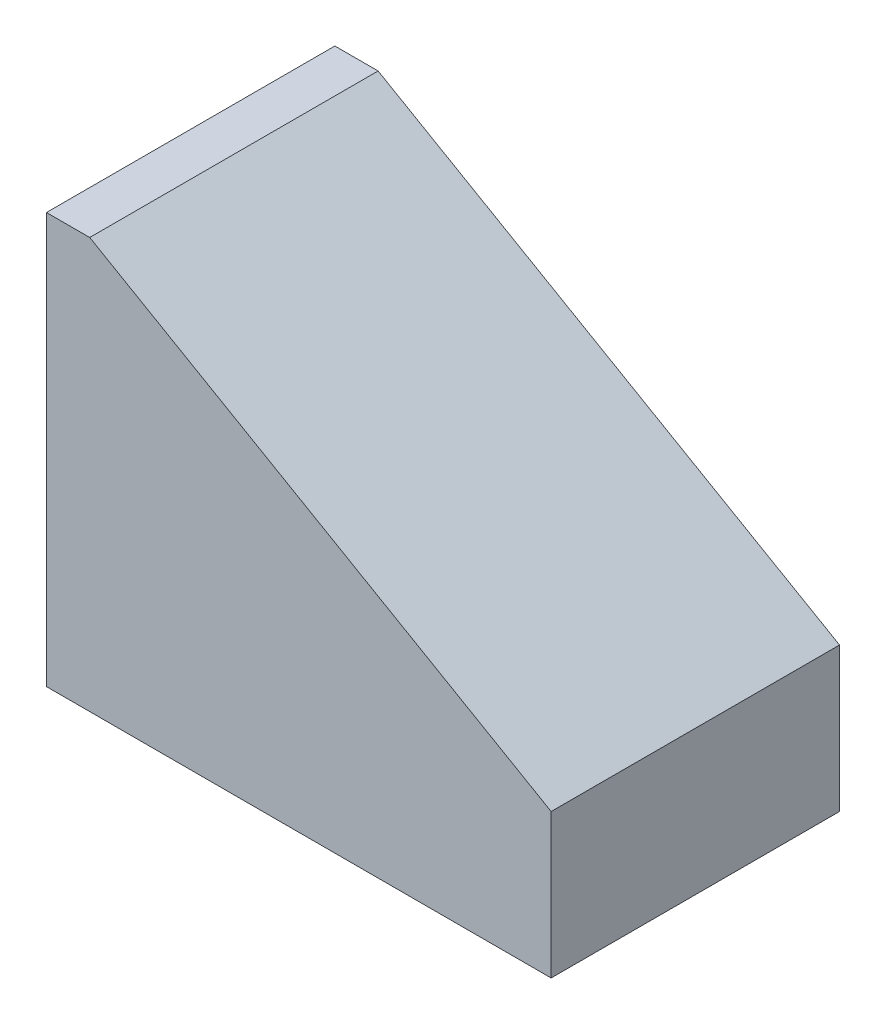
from build123d import *

# Parameters (mm, degrees)
BOSS_EXTRUDE1_DEPTH = 100


with BuildPart() as part:
    # Sketch1 → Boss-Extrude1 (new, symmetric)
    with BuildSketch(Plane.XY):
        Polygon((0, 0), (-350, 0), (-350, 284.752086141), (-320, 284.752086141), (0, 100), align=None)
    extrude(amount=BOSS_EXTRUDE1_DEPTH, both=True)


solid = part.part
